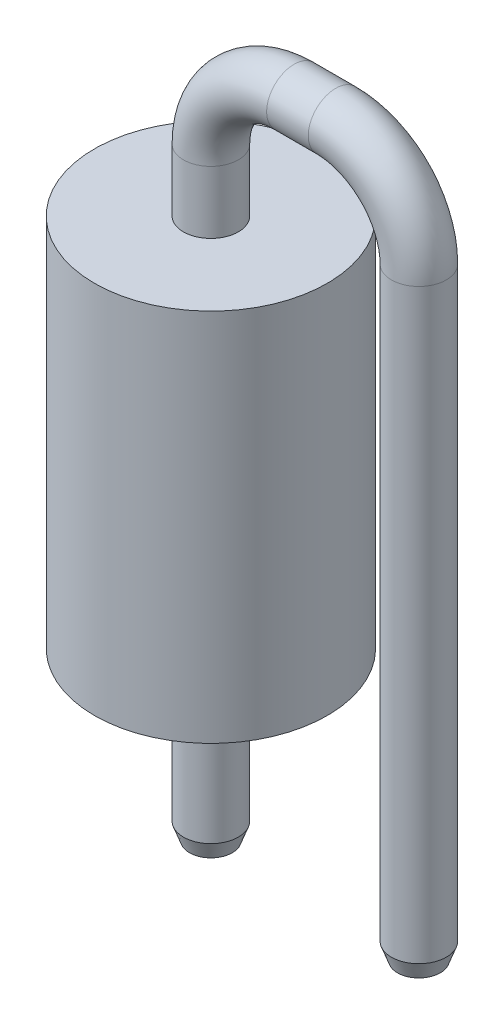
from build123d import *
from OCP.BRepFilletAPI import BRepFilletAPI_MakeChamfer

# Parameters (mm, degrees)
SKETCH_1_R      = 0.66
EXTRUDE_START   = 4
SKETCH_3_R      = 2.8
EXTRUDE_1_DEPTH = 9
CHAMFER_1_SIZE  = 0.4
CHAMFER_1_SIZE2 = 0.145588094


with BuildPart() as part:
    # По траектории1: sweep along a path in Эскиз2
    with BuildLine(Plane.XY) as sweep_1_path:
        Line((0, 0), (0, 14.5))
        ThreePointArc((0, 14.5), (0.585786438, 15.914213562), (2, 16.5))
        Line((2, 16.5), (3, 16.5))
        ThreePointArc((3, 16.5), (4.414213562, 15.914213562), (5, 14.5))
        Line((5, 14.5), (5, 0))
    # Эскиз1 → По траектории1 (sweep)
    with BuildSketch(Plane(origin=(0, 0, 0), x_dir=(1, 0, 0), z_dir=(0, 1, 0))):
        Circle(SKETCH_1_R)
    sweep(path=sweep_1_path.line)

    # Эскиз3 → Бобышка-Вытянуть1 (add)
    with BuildSketch(Plane(origin=(0, 0, 0), x_dir=(1, 0, 0), z_dir=(0, 1, 0)).offset(EXTRUDE_START)):
        with Locations(Location((0, 0, 0), (0, 0, 270))):
            Circle(SKETCH_3_R)
    extrude(amount=EXTRUDE_1_DEPTH)

    # Фаска1: one chamfer whose edges measure the first distance from different faces: ONE call of the kernel's chamfer builder (chamfer() names one face for all edges)
    chamfer_1_edges_1 = [part.edges().sort_by_distance(p)[0] for p in [
        (-0.66, 0, 0),
    ]]
    chamfer_1_side_1 = [part.faces().sort_by_distance(p)[0] for p in [
        (-0.66, 2, 0),
    ]]
    chamfer_1_edges_2 = [part.edges().sort_by_distance(p)[0] for p in [
        (5.66, 0, 0),
    ]]
    chamfer_1_side_2 = [part.faces().sort_by_distance(p)[0] for p in [
        (5.66, 7.25, 0),
    ]]
    chamfer_1 = BRepFilletAPI_MakeChamfer(part.part.solid().wrapped)
    for e in chamfer_1_edges_1:
        chamfer_1.Add(CHAMFER_1_SIZE, CHAMFER_1_SIZE2, e.wrapped, chamfer_1_side_1[0].wrapped)  # the first distance lies on this face
    for e in chamfer_1_edges_2:
        chamfer_1.Add(CHAMFER_1_SIZE, CHAMFER_1_SIZE2, e.wrapped, chamfer_1_side_2[0].wrapped)  # the first distance lies on this face
    add(Compound.cast(chamfer_1.Shape()), mode=Mode.REPLACE)


solid = part.part
